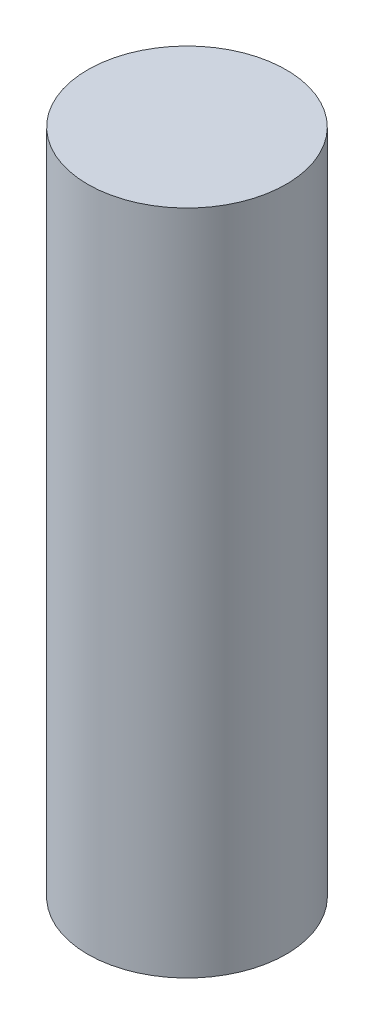
from build123d import *

# Parameters (mm, degrees)
SKETCH1_R           = 3.571875
BOSS_EXTRUDE1_DEPTH = 24


with BuildPart() as part:
    # Sketch1 → Boss-Extrude1 (new body)
    with BuildSketch(Plane(origin=(0, 0, 0), x_dir=(1, 0, 0), z_dir=(0, 1, 0))):
        with Locations(Location((0, 0, 0), (0, 0, 270))):
            Circle(SKETCH1_R)
    extrude(amount=BOSS_EXTRUDE1_DEPTH)


solid = part.part
